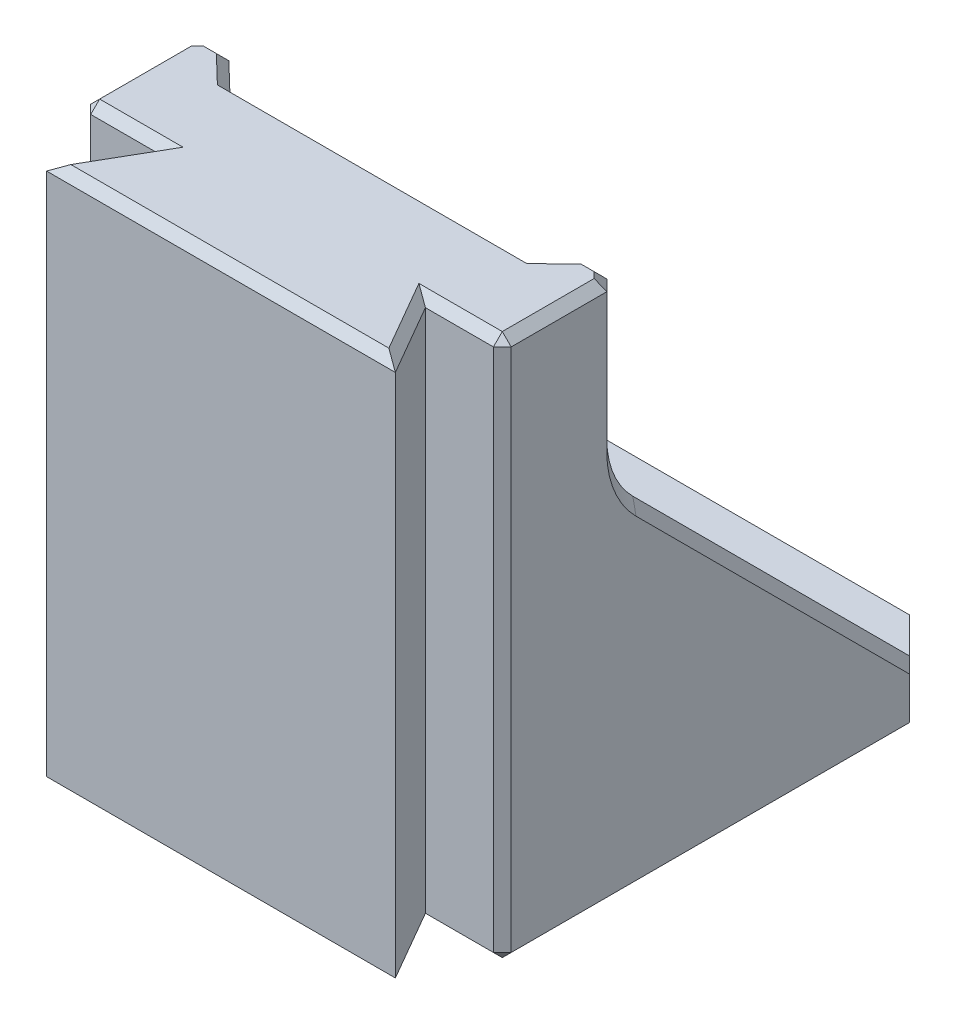
from build123d import *

# Parameters (mm, degrees)
SKETCH1_R                       = 1.5
SKETCH1_R_2                     = 11.5
BRACKET_FACE_EXTRUDE_DEPTH      = 5
BRACKET_BODY_EXTRUDE_DEPTH      = 61
BRACKET_SIDE_TRIM_DEPTH         = 73.461334517
BRACKET_SIDE_TRIM_DEPTH_BACK    = 73.461334517
BRACKET_SIDE_EDGE_CHAMFER_SIZE  = 1.25
BRACKET_MOUNT_HOLE_CHAMFER_SIZE = 0.75
SLIDE_TAB_EXTRUDE_DEPTH         = 61
BRACKET_FACE_CHAMFER_SIZE       = 1


with BuildPart() as part:
    # Sketch1 → Bracket Face Extrude (new body)
    with BuildSketch(Plane(origin=(0, 0, 0), x_dir=(1, 0, 0), z_dir=(0, 1, 0))):
        Polygon((-21.15, 17.15), (-17.15, 21.15), (17.15, 21.15), (21.15, 17.15), (21.15, -17.15), (17, -21.15), (-17, -21.15), (-21.15, -17.15), align=None)
        with Locations(Location((-15.5, 15.5, 0), (0, 0, 270))):
            Circle(SKETCH1_R, mode=Mode.SUBTRACT)
        with Locations(Location((15.5, 15.5, 0), (0, 0, 270))):
            Circle(SKETCH1_R, mode=Mode.SUBTRACT)
        with Locations(Location((15.5, -15.5, 0), (0, 0, 270))):
            Circle(SKETCH1_R, mode=Mode.SUBTRACT)
        with Locations(Location((-15.5, -15.5, 0), (0, 0, 270))):
            Circle(SKETCH1_R, mode=Mode.SUBTRACT)
        with Locations(Location((0, 0, 0), (0, 0, 270))):
            Circle(SKETCH1_R_2, mode=Mode.SUBTRACT)
    extrude(amount=BRACKET_FACE_EXTRUDE_DEPTH)

    # Sketch5 → Bracket Body Extrude (add)
    with BuildSketch(Plane(origin=(0, 0, 0), x_dir=(1, 0, 0), z_dir=(0, 1, 0))):
        Polygon((-23.65, -18.212588103), (-23.65, -31.15), (23.65, -31.15), (23.65, -18.212588103), (23.65, 14.65), (21.15, 17.15), (21.15, -17.15), (17, -21.15), (-17, -21.15), (-21.15, -17.15), (-21.15, 17.15), (-23.65, 14.65), align=None)
    extrude(amount=BRACKET_BODY_EXTRUDE_DEPTH)

    # Sketch6 → Bracket Side Trim (cut, two sides: drawn at the far end of the back side and taken through both)
    with BuildSketch(Plane(origin=(0, 0, 0), x_dir=(0, 0, -1), z_dir=(1, 0, 0)).offset(-BRACKET_SIDE_TRIM_DEPTH_BACK)):
        with BuildLine():
            Line((17.15, 5), (-15.221067812, 37.371067812))
            ThreePointArc((-15.221067812, 37.371067812), (-17.388795325, 40.6153013), (-18.15, 44.442135624))
            Line((-18.15, 44.442135624), (-18.15, 61))
            Line((-18.15, 61), (17.15, 61))
            Line((17.15, 61), (17.15, 5))
        make_face()
    extrude(amount=BRACKET_SIDE_TRIM_DEPTH + BRACKET_SIDE_TRIM_DEPTH_BACK, mode=Mode.SUBTRACT)

    # Bracket Side Edge Chamfer
    bracket_side_edge_chamfer_edges = [part.edges().sort_by_distance(p)[0] for p in [
        (-23.65, 22.435533906, 0.285533906),
        (-23.65, 40.6153013, 17.388795325),
        (-23.65, 52.721067812, 18.15),
        (23.65, 52.721067812, 18.15),
        (23.65, 40.6153013, 17.388795325),
        (23.65, 22.435533906, 0.285533906),
    ]]
    chamfer(bracket_side_edge_chamfer_edges, length=BRACKET_SIDE_EDGE_CHAMFER_SIZE)

    # Bracket Mount Hole Chamfer
    bracket_mount_hole_chamfer_edges = [part.edges().sort_by_distance(p)[0] for p in [
        (-15.5, 0, -17),
        (15.5, 0, -17),
        (15.5, 0, 14),
        (-15.5, 0, 14),
    ]]
    chamfer(bracket_mount_hole_chamfer_edges, length=BRACKET_MOUNT_HOLE_CHAMFER_SIZE)

    # Sketch9 → Slide Tab Extrude (add)
    with BuildSketch(Plane(origin=(0, 0, 0), x_dir=(1, 0, 0), z_dir=(0, 1, 0))):
        Polygon((-15, -31.15), (-19.618802154, -39.15), (19.618802154, -39.15), (15, -31.15), align=None)
    extrude(amount=SLIDE_TAB_EXTRUDE_DEPTH)

    # Bracket Face Chamfer
    bracket_face_chamfer_edges = [part.edges().sort_by_distance(p)[0] for p in [
        (-23.65, 61, 25.275),
        (-21.25625, 61, 18.15),
        (23.025, 61, 18.775),
        (-23.025, 61, 18.775),
        (19.325, 0, 31.15),
        (19.325, 61, 31.15),
        (-17.309401077, 0, 35.15),
        (0, 0, 39.15),
        (17.309401077, 0, 35.15),
        (17.309401077, 61, 35.15),
        (-17.309401077, 61, 35.15),
        (0, 61, 39.15),
        (-23.65, 0, 8.25),
        (-19.325, 0, 31.15),
        (-23.65, 30.5, 31.15),
        (23.65, 0, 8.25),
        (23.65, 30.5, 31.15),
        (-19.325, 61, 31.15),
        (23.65, 61, 25.275),
        (0, 61, 21.15),
        (-18.55625, 61, 19.65),
        (18.55625, 61, 19.65),
        (21.25625, 61, 18.15),
        (-20.4, 0, -17.9),
        (0, 0, -21.15),
        (20.4, 0, -17.9),
    ]]
    chamfer(bracket_face_chamfer_edges, length=BRACKET_FACE_CHAMFER_SIZE)


solid = part.part
